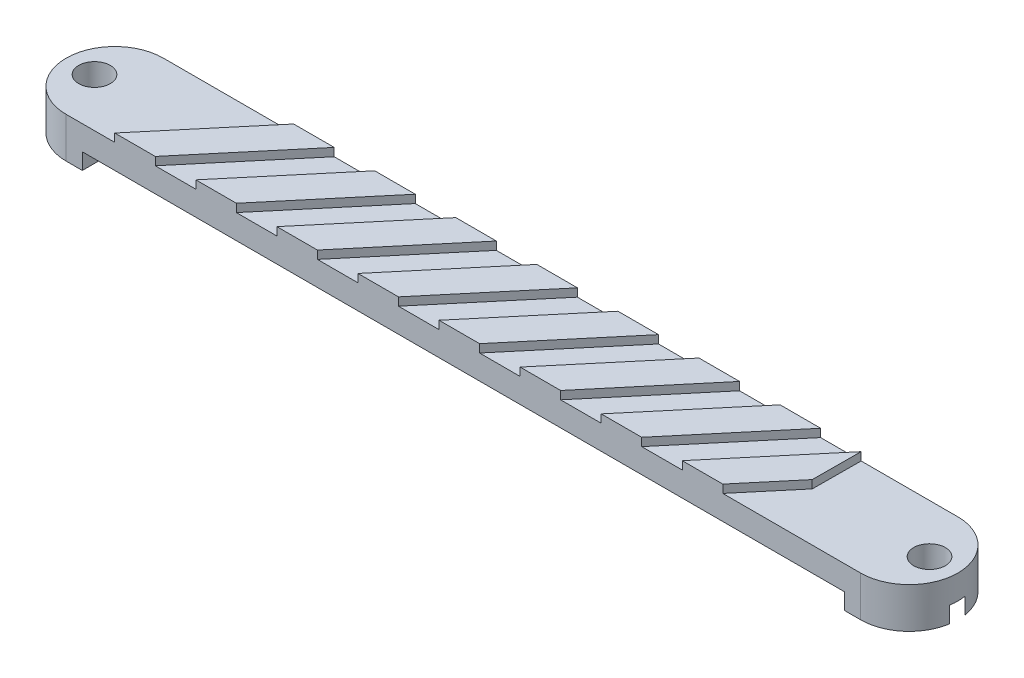
from build123d import *

# Parameters (mm, degrees)
SKETCH1_R           = 1.95
BOSS_EXTRUDE1_DEPTH = 3
BOSS_EXTRUDE2_START = 2
BOSS_EXTRUDE2_DEPTH = 2
BOSS_EXTRUDE3_DEPTH = 1


with BuildPart() as part:
    # Sketch1 → Boss-Extrude1 (new body)
    with BuildSketch(Plane(origin=(0, 0, 0), x_dir=(1, 0, 0), z_dir=(0, 1, 0))):
        with BuildLine():
            Line((-49, 6), (49, 6))
            ThreePointArc((49, 6), (55, 0), (49, -6))
            Line((49, -6), (-49, -6))
            ThreePointArc((-49, -6), (-55, 0), (-49, 6))
        make_face()
        with Locations(Location((-51.5, 0, 0), (0, 0, 270))):
            Circle(SKETCH1_R, mode=Mode.SUBTRACT)
        with Locations(Location((51.5, 0, 0), (0, 0, 270))):
            Circle(SKETCH1_R, mode=Mode.SUBTRACT)
    extrude(amount=BOSS_EXTRUDE1_DEPTH)

    # Sketch2 → Boss-Extrude2 (add)
    with BuildSketch(Plane.XZ.offset(BOSS_EXTRUDE2_START)):
        with BuildLine():
            Line((54.920031913, -0.976330963), (53.491858429, -3.45))
            Line((53.491858429, -3.45), (49.508141571, -3.45))
            Line((49.508141571, -3.45), (47.516283143, 0))
            Line((47.516283143, 0), (49.508141571, 3.45))
            Line((49.508141571, 3.45), (53.491858429, 3.45))
            Line((53.491858429, 3.45), (54.920031913, 0.976330963))
            ThreePointArc((54.920031913, 0.976330963), (52.882139502, 4.574821624), (49, 6))
            Line((49, 6), (47, 6))
            Line((47, 6), (47, -6))
            Line((47, -6), (49, -6))
            ThreePointArc((49, -6), (52.882139502, -4.574821624), (54.920031913, -0.976330963))
        make_face()
        with BuildLine():
            Line((-49, -6), (-47, -6))
            Line((-47, -6), (-47, 6))
            Line((-47, 6), (-49, 6))
            ThreePointArc((-49, 6), (-52.882139502, 4.574821624), (-54.920031913, 0.976330963))
            Line((-54.920031913, 0.976330963), (-53.491858429, 3.45))
            Line((-53.491858429, 3.45), (-49.508141571, 3.45))
            Line((-49.508141571, 3.45), (-47.516283143, 0))
            Line((-47.516283143, 0), (-49.508141571, -3.45))
            Line((-49.508141571, -3.45), (-53.491858429, -3.45))
            Line((-53.491858429, -3.45), (-54.920031913, -0.976330963))
            ThreePointArc((-54.920031913, -0.976330963), (-52.882139502, -4.574821624), (-49, -6))
        make_face()
    extrude(amount=-BOSS_EXTRUDE2_DEPTH)

    # Sketch3 → Boss-Extrude3 (add)
    with BuildSketch(Plane(origin=(0, 3, 0), x_dir=(1, 0, 0), z_dir=(0, 1, 0))):
        Polygon((-32.930804426, 6), (-43, -6), (-38, -6), (-27.930804426, 6), align=None)
        Polygon((-17.930804426, 6), (-22.930804426, 6), (-33, -6), (-28, -6), align=None)
        Polygon((-7.930804426, 6), (-12.930804426, 6), (-23, -6), (-18, -6), align=None)
        Polygon((2.069195574, 6), (-2.930804426, 6), (-13, -6), (-8, -6), align=None)
        Polygon((12.069195574, 6), (7.069195574, 6), (-3, -6), (2, -6), align=None)
        Polygon((22.069195574, 6), (17.069195574, 6), (7, -6), (12, -6), align=None)
        Polygon((32.069195574, 6), (27.069195574, 6), (17, -6), (22, -6), align=None)
        Polygon((37.069195574, 6), (27, -6), (32, -6), (37.034597787, 0), align=None)
    extrude(amount=BOSS_EXTRUDE3_DEPTH)


solid = part.part
